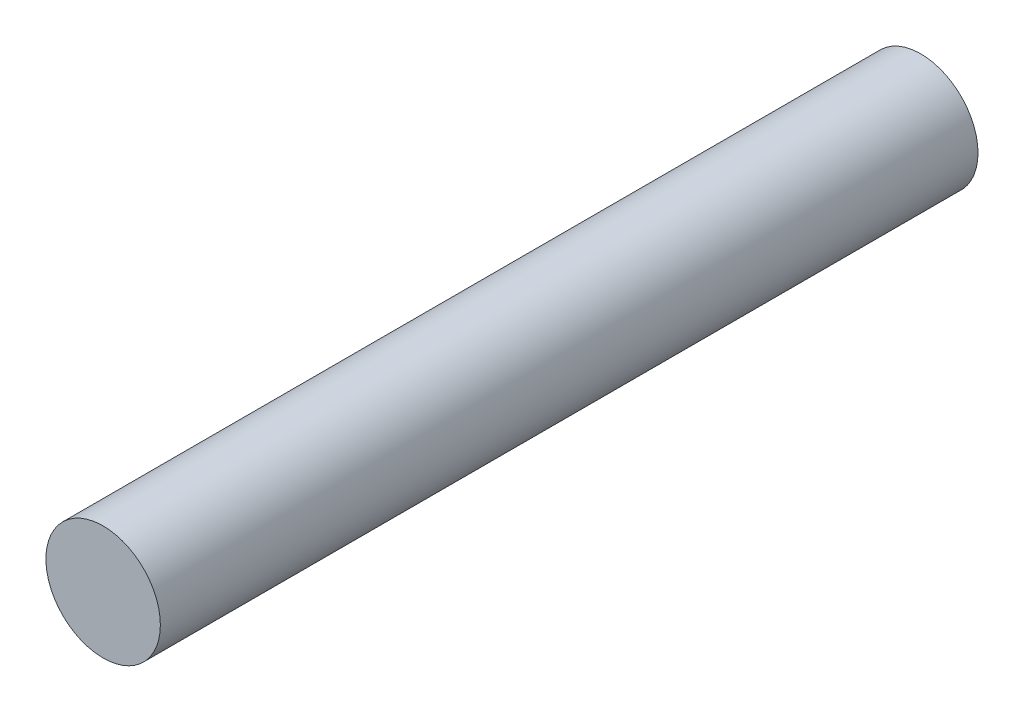
from build123d import *

# Parameters (mm, degrees)
ESQUISSE1_R        = 1.05
BOSS_EXTRU_1_DEPTH = 15


with BuildPart() as part:
    # Esquisse1 → Boss.-Extru.1 (new body)
    with BuildSketch(Plane.XY):
        with Locations((-5.591047199, 1.711992037)):
            Circle(ESQUISSE1_R)
    extrude(amount=BOSS_EXTRU_1_DEPTH)


solid = part.part
